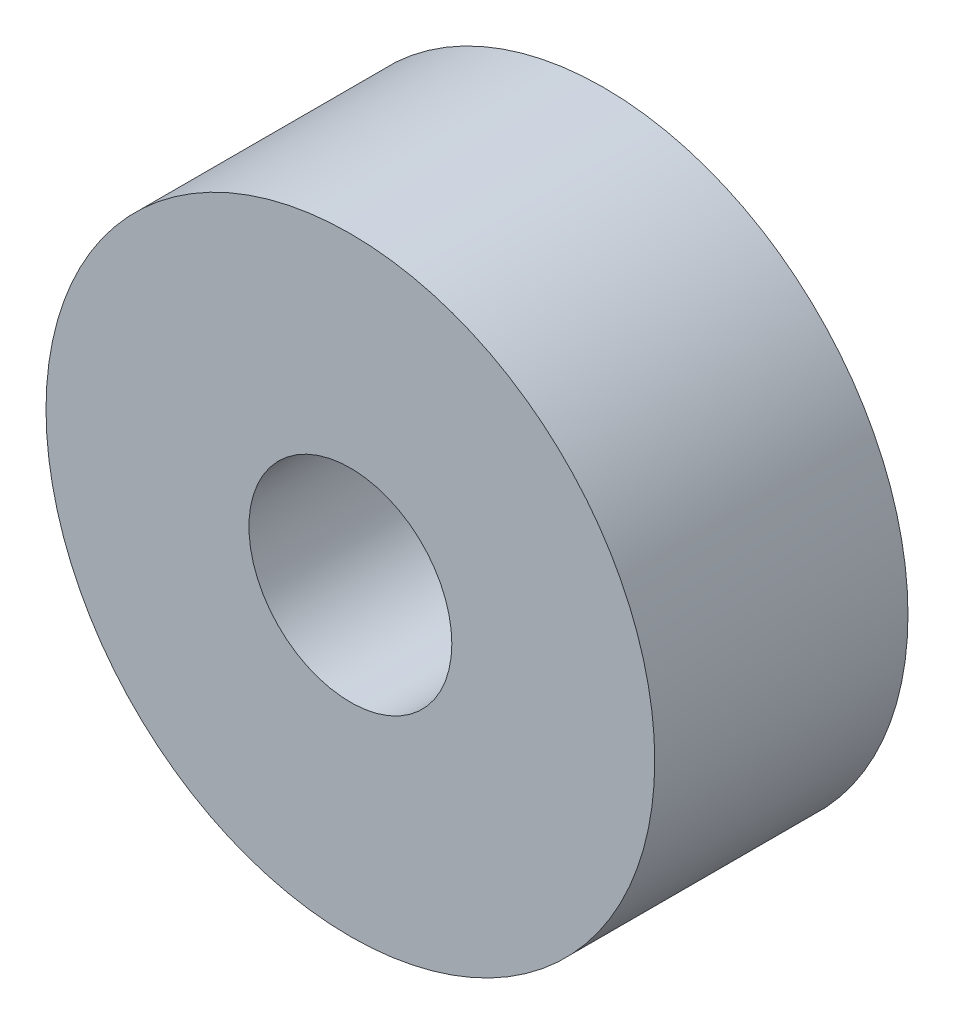
from build123d import *

# Parameters (mm, degrees)
SKETCH1_R           = 4.7625
SKETCH1_R_2         = 1.5875
BOSS_EXTRUDE1_DEPTH = 3.9624


with BuildPart() as part:
    # Sketch1 → Boss-Extrude1 (new body)
    with BuildSketch(Plane.XY):
        Circle(SKETCH1_R)
        Circle(SKETCH1_R_2, mode=Mode.SUBTRACT)
    extrude(amount=BOSS_EXTRUDE1_DEPTH)


solid = part.part
